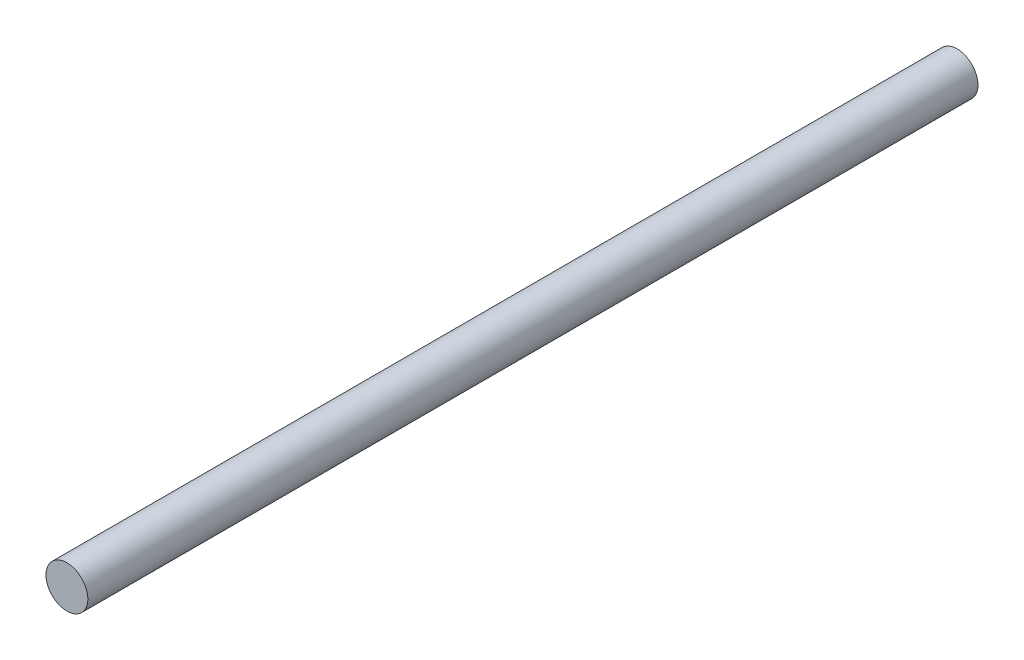
from build123d import *

# Parameters (mm, degrees)
SKETCH_1_R      = 6
EXTRUDE_1_DEPTH = 255


with BuildPart() as part:
    # 草图1 → 凸台-拉伸1 (new body)
    with BuildSketch(Plane.XY):
        Circle(SKETCH_1_R)
    extrude(amount=EXTRUDE_1_DEPTH)


solid = part.part
